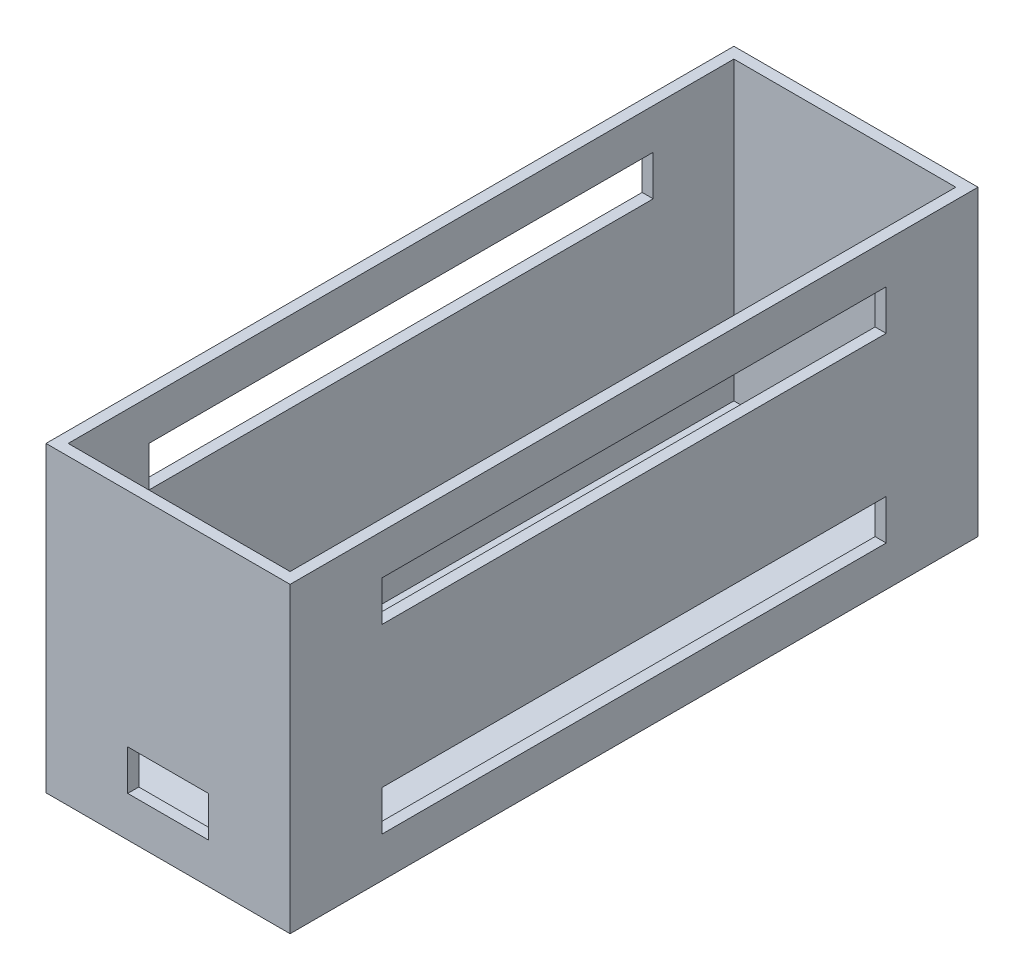
from build123d import *

# Parameters (mm, degrees)
SKETCH1_W           = 60.5
SKETCH1_H           = 75
BOSS_EXTRUDE1_DEPTH = 85.25
SKETCH2_W           = 55
SKETCH2_H           = 165
CUT_EXTRUDE1_DEPTH  = 73.375
SKETCH3_W           = 20
SKETCH3_H           = 10
CUT_EXTRUDE2_DEPTH  = 2.75
SKETCH7_W           = 125
SKETCH7_H           = 10
CUT_EXTRUDE4_DEPTH  = 112.058824503


with BuildPart() as part:
    # Sketch1 → Boss-Extrude1 (new, symmetric)
    with BuildSketch(Plane.XY):
        Rectangle(SKETCH1_W, SKETCH1_H)
    extrude(amount=BOSS_EXTRUDE1_DEPTH, both=True)

    # Sketch2 → Cut-Extrude1 (cut)
    with BuildSketch(Plane(origin=(0, 37.5, 0), x_dir=(1, 0, 0), z_dir=(0, 1, 0))):
        Rectangle(SKETCH2_W, SKETCH2_H)
    extrude(amount=-CUT_EXTRUDE1_DEPTH, mode=Mode.SUBTRACT)

    # Sketch3 → Cut-Extrude2 (cut)
    with BuildSketch(Plane.XY.offset(85.25)):
        with Locations((0, -22.5)):
            Rectangle(SKETCH3_W, SKETCH3_H)
    extrude(amount=-CUT_EXTRUDE2_DEPTH, mode=Mode.SUBTRACT)

    # Sketch7 → Cut-Extrude4 (cut, through all)
    with BuildSketch(Plane.ZY.offset(30.25)):
        with Locations((0, -22.5)):
            Rectangle(SKETCH7_W, SKETCH7_H)
        with Locations((0, 22.5)):
            Rectangle(SKETCH7_W, SKETCH7_H)
    extrude(amount=-CUT_EXTRUDE4_DEPTH, mode=Mode.SUBTRACT)


solid = part.part
